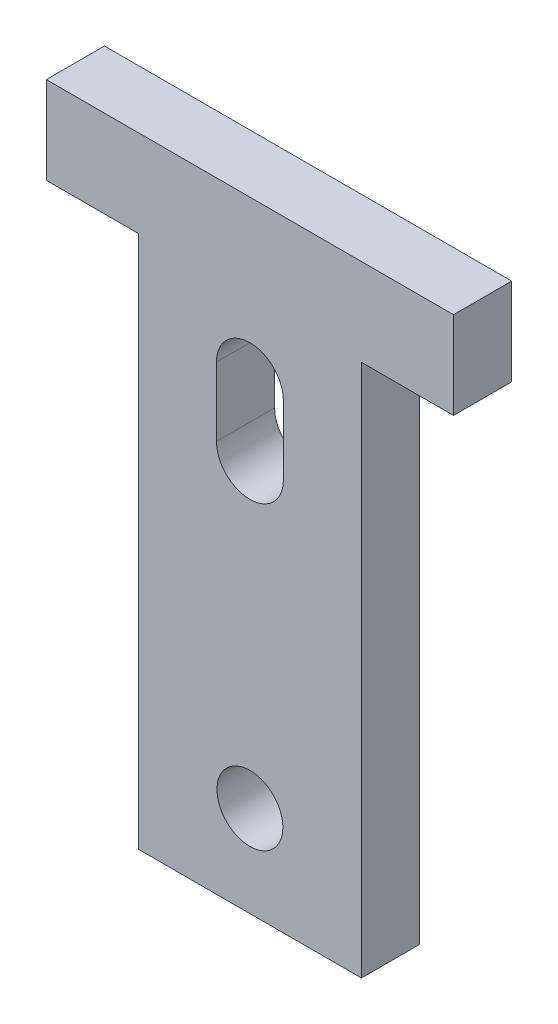
from build123d import *

# Parameters (mm, degrees)
BOSS_EXTRUDE1_DEPTH = 3
SKETCH2_R           = 1.7
CUT_EXTRUDE1_DEPTH  = 3


with BuildPart() as part:
    # Sketch1 → Boss-Extrude1 (new body)
    with BuildSketch(Plane.XY):
        Polygon((10.5, 20.853495779), (-10.5, 20.853495779), (-10.5, 16.353495779), (-5.75, 16.353495779), (-5.75, -11.146504221), (5.75, -11.146504221), (5.75, 16.353495779), (10.5, 16.353495779), align=None)
    extrude(amount=BOSS_EXTRUDE1_DEPTH)

    # Sketch2 → Cut-Extrude1 (cut)
    with BuildSketch(Plane.XY.offset(3)):
        with Locations((0, -6.446504221)):
            Circle(SKETCH2_R)
        with BuildLine():
            Line((1.725328859, 12.62816692), (1.725328859, 9.078824638))
            ThreePointArc((1.725328859, 9.078824638), (0, 7.353495779), (-1.725328859, 9.078824638))
            Line((-1.725328859, 9.078824638), (-1.725328859, 12.62816692))
            ThreePointArc((-1.725328859, 12.62816692), (0, 14.353495779), (1.725328859, 12.62816692))
        make_face()
    extrude(amount=-CUT_EXTRUDE1_DEPTH, mode=Mode.SUBTRACT)


solid = part.part
